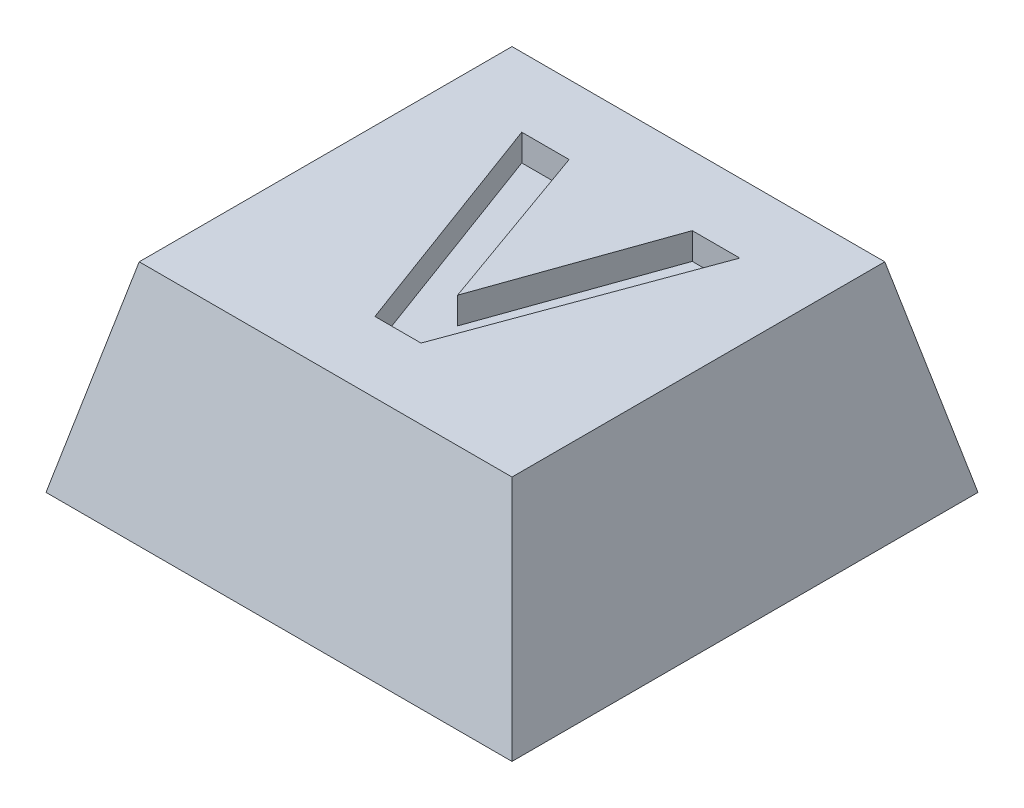
from build123d import *

# Parameters (mm, degrees)
SKETCH1_W           = 7
SKETCH1_H           = 7
BOSS_EXTRUDE1_DEPTH = 3
CUT_EXTRUDE1_DEPTH  = 7
CUT_EXTRUDE2_DEPTH  = 11
SKETCH4_R           = 1.8
CUT_EXTRUDE3_DEPTH  = 0.8
CUT_EXTRUDE4_DEPTH  = 0.4


with BuildPart() as part:
    # Sketch1 → Boss-Extrude1 (new body)
    with BuildSketch(Plane(origin=(0, 0, 0), x_dir=(1, 0, 0), z_dir=(0, 1, 0))):
        with Locations((3.5, 3.5)):
            Rectangle(SKETCH1_W, SKETCH1_H)
    extrude(amount=BOSS_EXTRUDE1_DEPTH)

    # Sketch2 → Cut-Extrude1 (cut)
    with BuildSketch(Plane.XY):
        Polygon((0, 0), (0.7, 3), (0, 3), align=None)
        Polygon((7, 0), (6.3, 3), (7, 3), align=None)
    extrude(amount=-CUT_EXTRUDE1_DEPTH, mode=Mode.SUBTRACT)

    # Sketch3 → Cut-Extrude2 (cut)
    with BuildSketch(Plane(origin=(0, 0, 0), x_dir=(0, 0, -1), z_dir=(1, 0, 0))):
        Polygon((0, 0), (0.7, 3), (0, 3), align=None)
        Polygon((7, 3), (6.3, 3), (7, 0), align=None)
    extrude(amount=CUT_EXTRUDE2_DEPTH, mode=Mode.SUBTRACT)

    # Sketch4 → Cut-Extrude3 (cut)
    with BuildSketch(Plane.XZ):
        with Locations(Location((3.5, -3.5, 0), (0, 0, 270))):
            Circle(SKETCH4_R)
    extrude(amount=-CUT_EXTRUDE3_DEPTH, mode=Mode.SUBTRACT)

    # Sketch5 → Cut-Extrude4 (cut)
    with BuildSketch(Plane(origin=(0, 3, 0), x_dir=(1, 0, 0), z_dir=(0, 1, 0))):
        Polygon((3.18174557, 1.759282352), (1.887474737, 5.259282352), (2.598412237, 5.259282352), (3.525295249, 2.656718249), (4.448672653, 5.259282352), (5.163115762, 5.259282352), (3.873752781, 1.759282352), align=None)
    extrude(amount=-CUT_EXTRUDE4_DEPTH, mode=Mode.SUBTRACT)


solid = part.part
